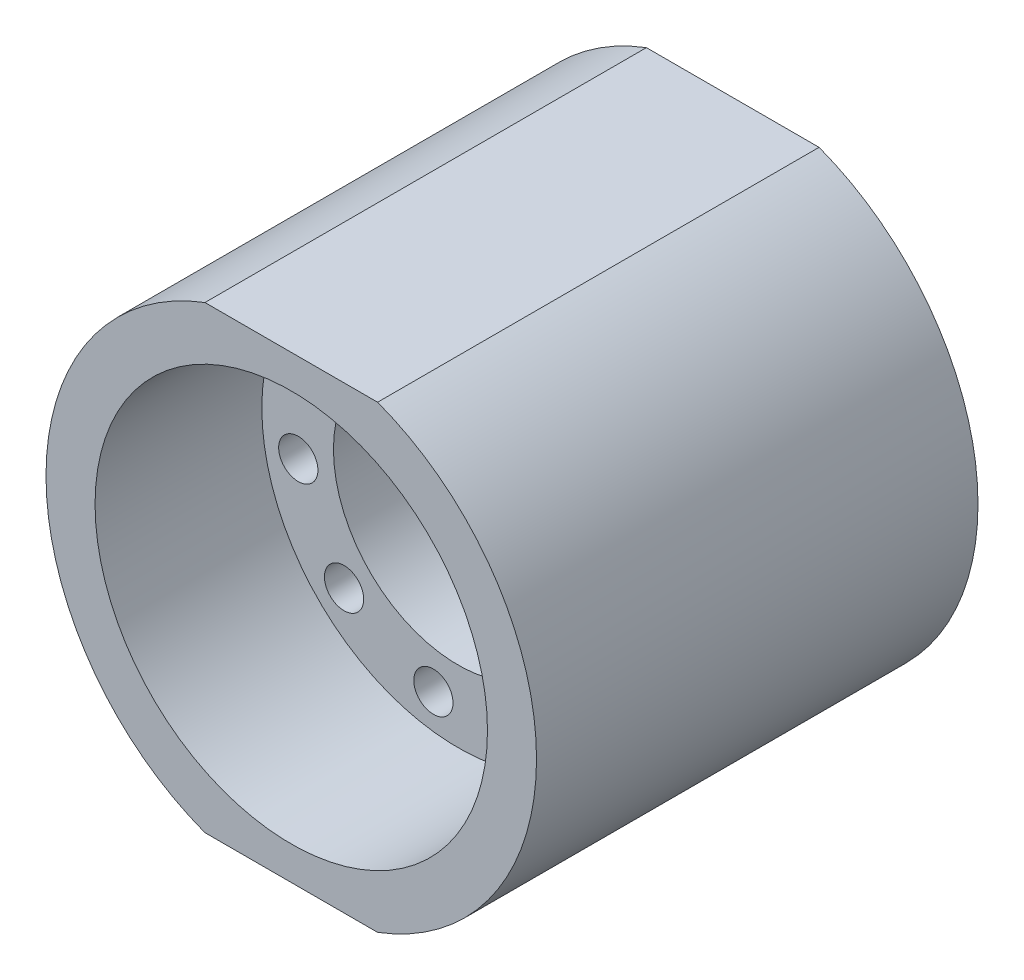
from build123d import *

# Parameters (mm, degrees)
SKETCH1_R           = 25
BOSS_EXTRUDE1_DEPTH = 45
SKETCH2_R           = 20
CUT_EXTRUDE1_DEPTH  = 17
SKETCH3_R           = 12.7
CUT_EXTRUDE2_DEPTH  = 18
SKETCH4_R           = 2
CUT_EXTRUDE3_DEPTH  = 46.099889135
CIRPATTERN1_COUNT   = 10
CUT_EXTRUDE4_START  = -20
SKETCH5_R           = 20
CUT_EXTRUDE4_DEPTH  = 20
CUT_EXTRUDE5_DEPTH  = 58.227615711


with BuildPart() as part:
    # Sketch1 → Boss-Extrude1 (new body)
    with BuildSketch(Plane.XY):
        with Locations(Location((0, 0, 0), (0, 0, 180))):
            Circle(SKETCH1_R)
    extrude(amount=BOSS_EXTRUDE1_DEPTH)

    # Sketch2 → Cut-Extrude1 (cut)
    with BuildSketch(Plane.XY.offset(45)):
        Circle(SKETCH2_R)
    extrude(amount=-CUT_EXTRUDE1_DEPTH, mode=Mode.SUBTRACT)

    # Sketch3 → Cut-Extrude2 (cut)
    with BuildSketch(Plane.XY.offset(28)):
        Circle(SKETCH3_R)
    extrude(amount=-CUT_EXTRUDE2_DEPTH, mode=Mode.SUBTRACT)

    # Sketch4 → Cut-Extrude3 (cut, through all)
    with BuildSketch(Plane.XY.offset(28)):
        with Locations((-7.552723676, 14.669913602)):
            Circle(SKETCH4_R)
    cut_extrude3 = extrude(amount=-CUT_EXTRUDE3_DEPTH, mode=Mode.SUBTRACT)

    # CirPattern1: Cut-Extrude3 ×10 about axis
    cirpattern1_axis = Axis((0, 0, 0), (0, 0, 1))
    for i in range(1, CIRPATTERN1_COUNT):
        add(cut_extrude3.rotate(cirpattern1_axis, i * 360 / CIRPATTERN1_COUNT), mode=Mode.SUBTRACT)

    # Sketch5 → Cut-Extrude4 (cut)
    with BuildSketch(Plane(origin=(0, 0, 0), x_dir=(-1, 0, 0), z_dir=(0, 0, -1)).offset(CUT_EXTRUDE4_START)):
        with Locations(Location((0, 0, 0), (0, 0, 180))):
            Circle(SKETCH5_R)
    extrude(amount=CUT_EXTRUDE4_DEPTH, mode=Mode.SUBTRACT)

    # Sketch6 → Cut-Extrude5 (cut, through all)
    with BuildSketch(Plane(origin=(0, 0, 0), x_dir=(-1, 0, 0), z_dir=(0, 0, -1))):
        with BuildLine():
            Line((-8.8, 23.4), (8.8, 23.4))
            ThreePointArc((8.8, 23.4), (0, 25), (-8.8, 23.4))
        make_face()
        with BuildLine():
            Line((-8.8, -23.4), (8.8, -23.4))
            ThreePointArc((8.8, -23.4), (0, -25), (-8.8, -23.4))
        make_face()
    extrude(amount=-CUT_EXTRUDE5_DEPTH, mode=Mode.SUBTRACT)


solid = part.part
